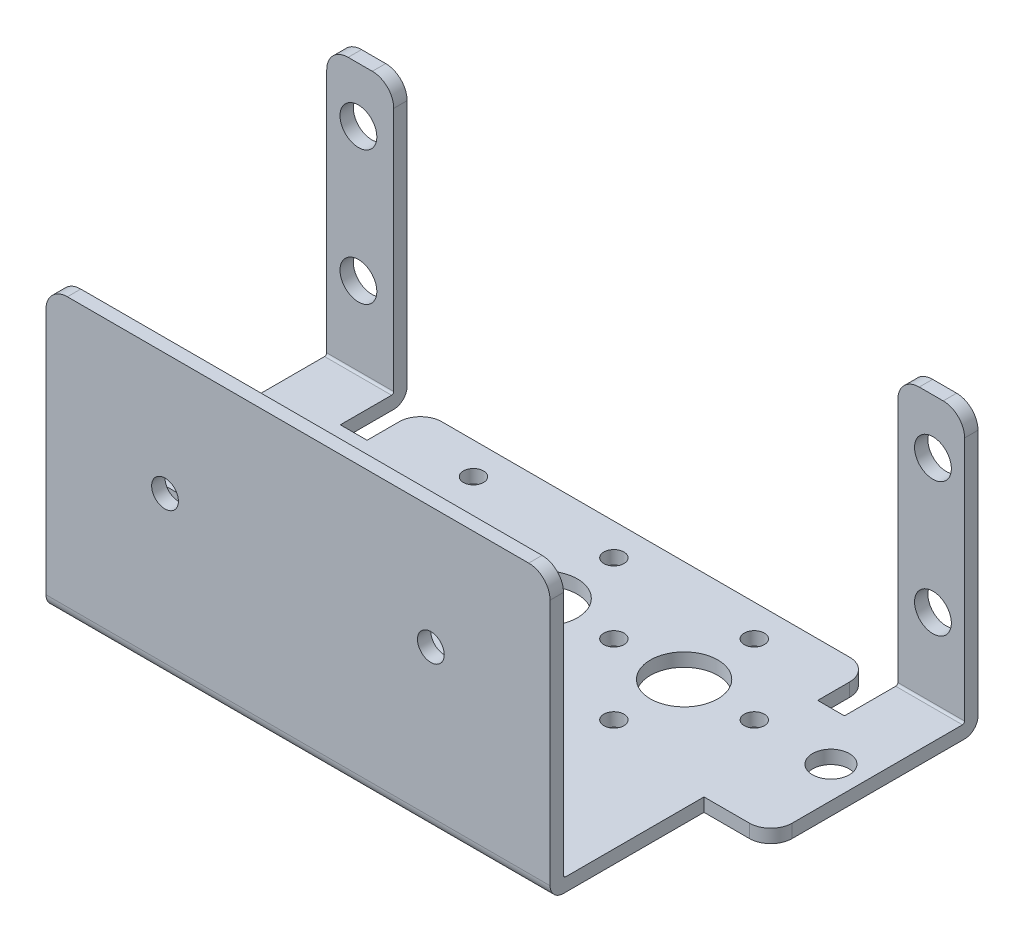
from build123d import *

# Parameters (mm, degrees)
EXTRUDE1_DEPTH             = 75.692
EXTRUDE2_REACH             = 95.199
SKETCH2_W                  = 7.9502
SKETCH2_H                  = 18.2626
SKETCH2_W_2                = 7.9248
EXTRUDE3_REACH             = 94.641
SKETCH3_W                  = 59.817
SKETCH3_H                  = 1.5875
EXTRUDE3_DIRECTION_2_REACH = 94.641
SKETCH4_W                  = 3.175
SKETCH4_H                  = 6.3373
EXTRUDE4_DEPTH             = 1.5875
SKETCH5_R                  = 4.0005
SKETCH5_R_2                = 1.1938
SKETCH5_R_3                = 2.1844
EXTRUDE5_DEPTH             = 1.5875
SKETCH6_R                  = 2.1844
SKETCH6_R_2                = 1.5875
EXTRUDE6_DEPTH             = 94.19928725
FILLET1_R                  = 2.54
FILLET2_R                  = 0.254
FILLET3_R                  = 2.54
FILLET4_R                  = 2.54


with BuildPart() as part:
    # Sketch1 → Extrude1 (new body)
    with BuildSketch(Plane(origin=(0, 0, 0), x_dir=(0, 0, -1), z_dir=(1, 0, 0))):
        with BuildLine():
            Line((1.5875, 33.4772), (1.5875, 1.5875))
            Line((1.5875, 1.5875), (41.2623, 1.5875))
            Line((41.2623, 1.5875), (41.2623, 33.4772))
            Line((41.2623, 33.4772), (42.8498, 33.4772))
            Line((42.8498, 33.4772), (42.8498, 1.5875))
            ThreePointArc((42.8498, 1.5875), (42.384832015, 0.464967985), (41.2623, 0))
            Line((41.2623, 0), (1.5875, 0))
            ThreePointArc((1.5875, 0), (0.464967985, 0.464967985), (0, 1.5875))
            Line((0, 1.5875), (0, 33.4772))
            Line((0, 33.4772), (1.5875, 33.4772))
        make_face()
    extrude(amount=EXTRUDE1_DEPTH)

    # Extrude2: up to this face of the body (flat: up to its plane)
    extrude2_end = Plane(part.part.faces().sort_by_distance((37.846, 0, -21.4249))[0])
    # Sketch2 → Extrude2 (cut, up to the picked face)
    with BuildSketch(Plane(origin=(0, 33.4772, 0), x_dir=(1, 0, 0), z_dir=(0, 1, 0)), mode=Mode.PRIVATE) as extrude2_sk1:
        with Locations((3.9751, 9.1313)):
            Rectangle(SKETCH2_W, SKETCH2_H)
    extrude2_tool1 = split(extrude(extrude2_sk1.sketch, amount=-EXTRUDE2_REACH, mode=Mode.PRIVATE), bisect_by=extrude2_end, keep=Keep.BOTH, mode=Mode.PRIVATE)
    # Sketch2 → Extrude2 (cut, up to the picked face)
    with BuildSketch(Plane(origin=(0, 33.4772, 0), x_dir=(1, 0, 0), z_dir=(0, 1, 0)), mode=Mode.PRIVATE) as extrude2_sk2:
        with Locations((71.7296, 9.1313)):
            Rectangle(SKETCH2_W_2, SKETCH2_H)
    extrude2_tool2 = split(extrude(extrude2_sk2.sketch, amount=-EXTRUDE2_REACH, mode=Mode.PRIVATE), bisect_by=extrude2_end, keep=Keep.BOTH, mode=Mode.PRIVATE)
    add(extrude2_tool1.solids().sort_by(Axis((3.9751, 33.4772, -9.1313), (0, -1, 0)))[0], mode=Mode.SUBTRACT)
    add(extrude2_tool2.solids().sort_by(Axis((71.7296, 33.4772, -9.1313), (0, -1, 0)))[0], mode=Mode.SUBTRACT)

    # Extrude3: up to this face of the body (flat: up to its plane)
    extrude3_end = Plane(part.part.faces().sort_by_distance((37.846, 33.4772, -42.05605))[0])
    # Sketch3 → Extrude3 (cut, up to the picked face)
    with BuildSketch(Plane(origin=(0, 1.5875, 0), x_dir=(1, 0, 0), z_dir=(0, 1, 0)), mode=Mode.PRIVATE) as extrude3_sk1:
        with Locations((37.8587, 42.05605)):
            Rectangle(SKETCH3_W, SKETCH3_H)
    extrude3_tool1 = split(extrude(extrude3_sk1.sketch, amount=EXTRUDE3_REACH, mode=Mode.PRIVATE), bisect_by=extrude3_end, keep=Keep.BOTH, mode=Mode.PRIVATE)
    add(extrude3_tool1.solids().sort_by(Axis((37.8587, 1.5875, -42.05605), (0, 1, 0)))[0], mode=Mode.SUBTRACT)

    # Extrude3 direction 2: up to this face of the body (flat: up to its plane)
    extrude3_direction_2_end = Plane(part.part.faces().sort_by_distance((37.850626027, 0, -22.536595268))[0])
    # Sketch3 → Extrude3 direction 2 (cut, up to the picked face)
    with BuildSketch(Plane(origin=(0, 1.5875, 0), x_dir=(1, 0, 0), z_dir=(0, 1, 0)), mode=Mode.PRIVATE) as extrude3_direction_2_sk1:
        with Locations((37.8587, 42.05605)):
            Rectangle(SKETCH3_W, SKETCH3_H)
    extrude3_direction_2_tool1 = split(extrude(extrude3_direction_2_sk1.sketch, amount=-EXTRUDE3_DIRECTION_2_REACH, mode=Mode.PRIVATE), bisect_by=extrude3_direction_2_end, keep=Keep.BOTH, mode=Mode.PRIVATE)
    add(extrude3_direction_2_tool1.solids().sort_by(Axis((37.8587, 1.5875, -42.05605), (0, -1, 0)))[0], mode=Mode.SUBTRACT)

    # Sketch4 → Extrude4 (cut)
    with BuildSketch(Plane(origin=(0, 1.5875, 0), x_dir=(1, 0, 0), z_dir=(0, 1, 0))):
        with Locations((9.5377, 38.09365)):
            Rectangle(SKETCH4_W, SKETCH4_H)
        with Locations((66.1797, 38.09365)):
            Rectangle(SKETCH4_W, SKETCH4_H)
    extrude(amount=-EXTRUDE4_DEPTH, mode=Mode.SUBTRACT)

    # Sketch5 → Extrude5 (cut)
    with BuildSketch(Plane(origin=(0, 1.5875, 0), x_dir=(1, 0, 0), z_dir=(0, 1, 0))):
        with Locations(Location((21.1836, 29.1592, 0), (0, 0, 270))):
            Circle(SKETCH5_R)
        with Locations(Location((21.1836, 37.4904, 0), (0, 0, 270))):
            Circle(SKETCH5_R_2)
        with Locations(Location((12.8524, 29.1592, 0), (0, 0, 270))):
            Circle(SKETCH5_R_2)
        with Locations(Location((21.1836, 20.828, 0), (0, 0, 270))):
            Circle(SKETCH5_R_2)
        with Locations(Location((37.846, 37.4904, 0), (0, 0, 270))):
            Circle(SKETCH5_R_2)
        with Locations(Location((29.5148, 29.1592, 0), (0, 0, 270))):
            Circle(SKETCH5_R_2)
        with Locations(Location((37.846, 20.828, 0), (0, 0, 270))):
            Circle(SKETCH5_R_2)
        with Locations(Location((37.846, 29.1592, 0), (0, 0, 270))):
            Circle(SKETCH5_R)
        with Locations(Location((54.5084, 20.828, 0), (0, 0, 270))):
            Circle(SKETCH5_R_2)
        with Locations(Location((54.5084, 29.1592, 0), (0, 0, 270))):
            Circle(SKETCH5_R)
        with Locations(Location((46.1772, 29.1592, 0), (0, 0, 270))):
            Circle(SKETCH5_R_2)
        with Locations(Location((54.5084, 37.4904, 0), (0, 0, 270))):
            Circle(SKETCH5_R_2)
        with Locations(Location((62.8396, 29.1592, 0), (0, 0, 270))):
            Circle(SKETCH5_R_2)
        with Locations(Location((3.7592, 29.1592, 0), (0, 0, 270))):
            Circle(SKETCH5_R_3)
        with Locations(Location((71.9328, 29.1592, 0), (0, 0, 270))):
            Circle(SKETCH5_R_3)
    extrude(amount=-EXTRUDE5_DEPTH, mode=Mode.SUBTRACT)

    # Sketch6 → Extrude6 (cut, through all)
    with BuildSketch(Plane.XY):
        with Locations((3.7592, 27.0002)):
            Circle(SKETCH6_R)
        with Locations((3.7592, 11.1252)):
            Circle(SKETCH6_R)
        with Locations((71.9328, 27.0002)):
            Circle(SKETCH6_R)
        with Locations((71.9328, 11.1252)):
            Circle(SKETCH6_R)
        with Locations((22.0726, 19.05)):
            Circle(SKETCH6_R_2)
        with Locations((53.6194, 19.05)):
            Circle(SKETCH6_R_2)
    extrude(amount=-EXTRUDE6_DEPTH, mode=Mode.SUBTRACT)

    # Fillet1
    fillet1_edges = [part.edges().sort_by_distance(p)[0] for p in [
        (64.5922, 0.79375, -41.2623),
        (0, 33.4772, -42.05605),
        (7.9502, 33.4772, -0.79375),
        (75.692, 33.4772, -42.05605),
        (75.692, 0.79375, -18.2626),
        (67.7672, 33.4772, -0.79375),
        (11.1252, 0.79375, -41.2623),
    ]]
    fillet(fillet1_edges, radius=FILLET1_R)

    # Fillet2
    fillet2_edges = [part.edges().sort_by_distance(p)[0] for p in [
        (71.7296, 1.5875, -41.2623),
        (37.8587, 1.5875, -1.5875),
        (3.9751, 1.5875, -41.2623),
    ]]
    fillet(fillet2_edges, radius=FILLET2_R)

    # Fillet3
    fillet3_edges = [part.edges().sort_by_distance(p)[0] for p in [
        (0, 0.79375, -18.2626),
    ]]
    fillet(fillet3_edges, radius=FILLET3_R)

    # Fillet4
    fillet4_edges = [part.edges().sort_by_distance(p)[0] for p in [
        (67.7672, 33.4772, -42.05605),
        (7.9502, 33.4772, -42.05605),
    ]]
    fillet(fillet4_edges, radius=FILLET4_R)


solid = part.part
